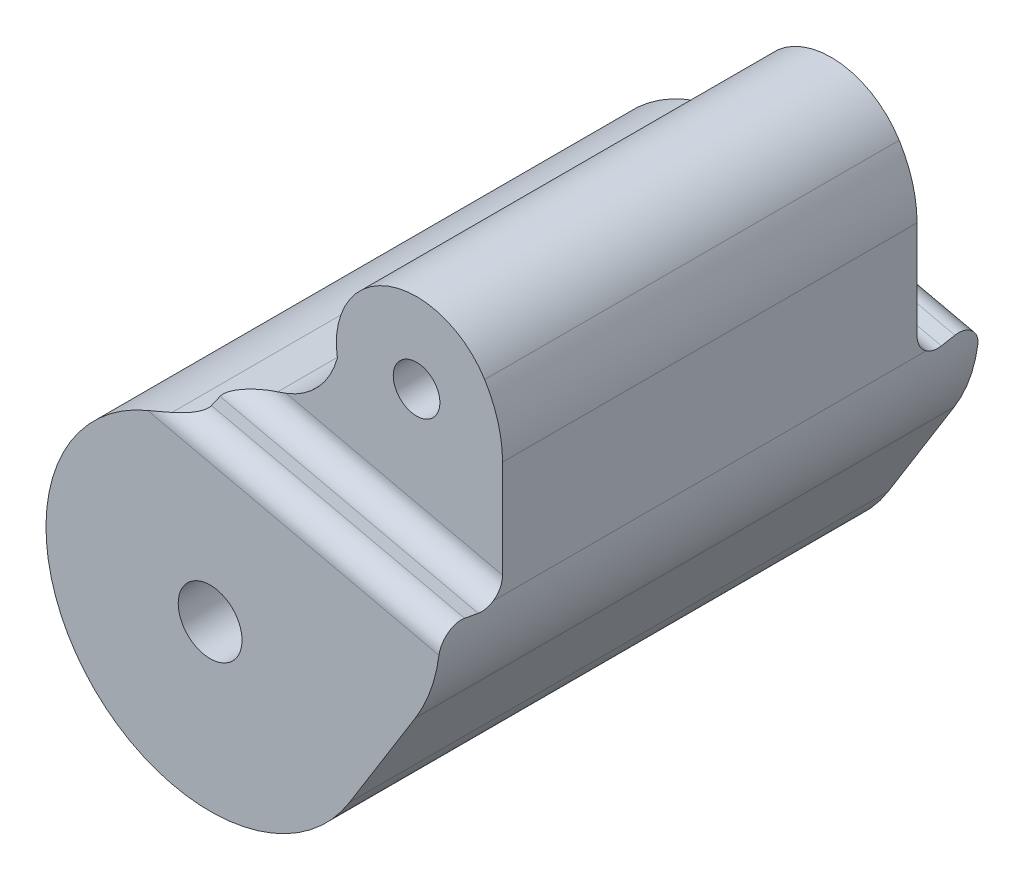
from build123d import *

# Parameters (mm, degrees)
SKETCH1_R           = 1.125
SKETCH1_R_2         = 1.54
BOSS_EXTRUDE1_DEPTH = 13
SKETCH2_R           = 1.125
CUT_EXTRUDE1_DEPTH  = 3
CUT_EXTRUDE1_TAPER  = -10
FILLET1_R           = 1
FILLET2_R           = 1
FILLET3_R           = 1
FILLET4_R           = 1


with BuildPart() as part:
    # Sketch1 → Boss-Extrude1 (new, symmetric)
    with BuildSketch(Plane.XY):
        with BuildLine():
            Line((8, 5.57), (8, 0))
            ThreePointArc((8, 0), (7.692956073, -2.195091538), (6.795393285, -4.221685695))
            Line((6.795393285, -4.221685695), (3.618574799, -9.335219142))
            ThreePointArc((3.618574799, -9.335219142), (-9.482620111, -9.856988447), (-5.1153336, 2.505873673))
            Line((-5.1153336, 2.505873673), (-2.830230063, 3.104309401))
            ThreePointArc((-2.830230063, 3.104309401), (-1.020355645, 4.136406118), (0.029802368, 5.93586081))
            ThreePointArc((0.029802368, 5.93586081), (2.498115044, 10.172124839), (7.138397607, 8.589001937))
            ThreePointArc((7.138397607, 8.589001937), (7.780383364, 7.13977159), (8, 5.57))
        make_face()
        with Locations(Location((3.85133489, 6.546425452, 0), (0, 0, 180))):
            Circle(SKETCH1_R, mode=Mode.SUBTRACT)
        with Locations(Location((-3.108864553, -5.155750304, 0), (0, 0, 180))):
            Circle(SKETCH1_R_2, mode=Mode.SUBTRACT)
    extrude(amount=BOSS_EXTRUDE1_DEPTH, both=True)

    # Sketch2 → Cut-Extrude1 (cut)
    with BuildSketch(Plane.XY.offset(13)):
        with BuildLine():
            Line((8, 0.172124839), (8, 5.57))
            ThreePointArc((8, 5.57), (7.780383364, 7.13977159), (7.138397607, 8.589001937))
            ThreePointArc((7.138397607, 8.589001937), (2.498115044, 10.172124839), (0.029802368, 5.93586081))
            ThreePointArc((0.029802368, 5.93586081), (-1.020355645, 4.136406118), (-2.830230063, 3.104309401))
            Line((-2.830230063, 3.104309401), (-3.781962396, 2.855064401))
            Line((-3.781962396, 2.855064401), (8, 0.172124839))
        make_face()
        with Locations(Location((3.85133489, 6.546425452, 0), (0, 0, 180))):
            Circle(SKETCH2_R, mode=Mode.SUBTRACT)
    cut_extrude1 = extrude(amount=-CUT_EXTRUDE1_DEPTH, taper=CUT_EXTRUDE1_TAPER, mode=Mode.SUBTRACT)

    # Mirror1: Cut-Extrude1 across plane
    add(cut_extrude1.mirror(Plane.XY), mode=Mode.SUBTRACT)

    # Fillet1
    fillet1_edges = [part.edges().sort_by_distance(p)[0] for p in [
        (2.109018802, 1.51359462, -13),
    ]]
    fillet(fillet1_edges, radius=FILLET1_R)

    # Fillet2
    fillet2_edges = [part.edges().sort_by_distance(p)[0] for p in [
        (2.109018802, 1.51359462, 13),
    ]]
    fillet(fillet2_edges, radius=FILLET2_R)

    # Fillet3
    fillet3_edges = [part.edges().sort_by_distance(p)[0] for p in [
        (1.550728698, 1.09820349, -10),
    ]]
    fillet(fillet3_edges, radius=FILLET3_R)

    # Fillet4
    fillet4_edges = [part.edges().sort_by_distance(p)[0] for p in [
        (1.550728698, 1.09820349, 10),
    ]]
    fillet(fillet4_edges, radius=FILLET4_R)


solid = part.part
